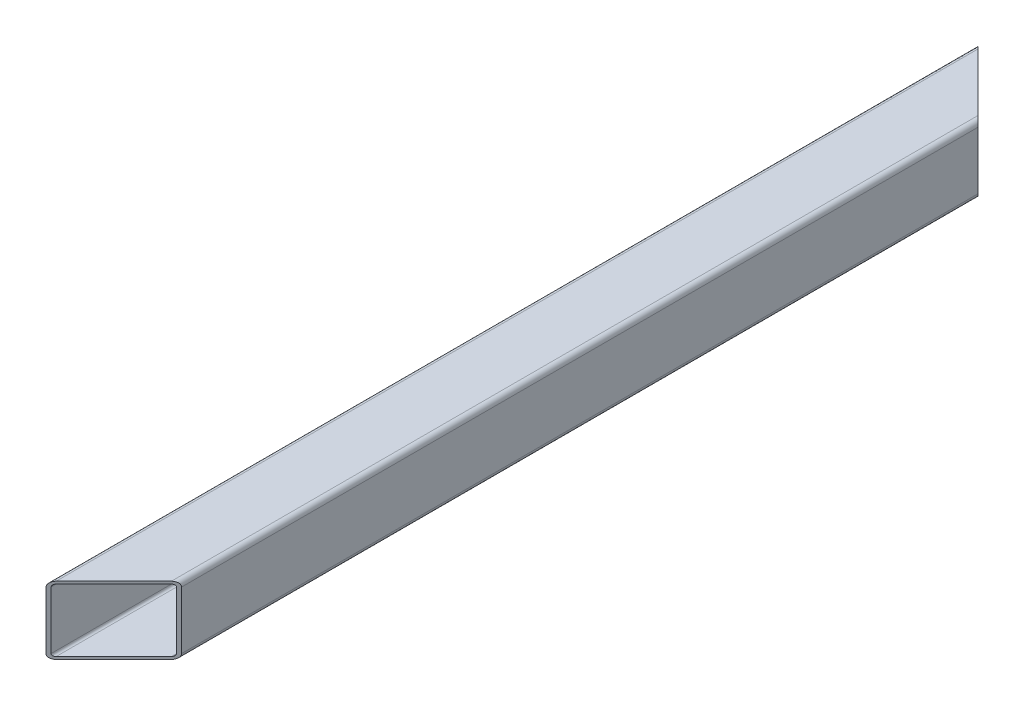
from build123d import *

# Parameters (mm, degrees)
AUFSATZ_LINEAR_AUSTRAGEN1_DEPTH = 550
SCHNITT_LINEAR_AUSTRAGEN1_DEPTH = 140


with BuildPart() as part:
    # Skizze1 → Aufsatz-Linear austragen1 (new, symmetric)
    with BuildSketch(Plane.XY):
        with BuildLine():
            Line((-34, 40), (34, 40))
            ThreePointArc((34, 40), (38.242640687, 38.242640687), (40, 34))
            Line((40, 34), (40, -34))
            ThreePointArc((40, -34), (38.242640687, -38.242640687), (34, -40))
            Line((34, -40), (-34, -40))
            ThreePointArc((-34, -40), (-38.242640687, -38.242640687), (-40, -34))
            Line((-40, -34), (-40, 34))
            ThreePointArc((-40, 34), (-38.242640687, 38.242640687), (-34, 40))
        make_face()
        with BuildLine():
            Line((-37, 34), (-37, -34))
            ThreePointArc((-37, -34), (-36.121320344, -36.121320344), (-34, -37))
            Line((-34, -37), (34, -37))
            ThreePointArc((34, -37), (36.121320344, -36.121320344), (37, -34))
            Line((37, -34), (37, 34))
            ThreePointArc((37, 34), (36.121320344, 36.121320344), (34, 37))
            Line((34, 37), (-34, 37))
            ThreePointArc((-34, 37), (-36.121320344, 36.121320344), (-37, 34))
        make_face(mode=Mode.SUBTRACT)
    extrude(amount=AUFSATZ_LINEAR_AUSTRAGEN1_DEPTH, both=True)

    # Skizze2 → Schnitt-Linear austragen1 (cut)
    with BuildSketch(Plane(origin=(0, 40, 0), x_dir=(1, 0, 0), z_dir=(0, 1, 0))):
        Polygon((-40, 550), (40, 550), (40, 470), align=None)
        Polygon((40, -470), (-40, -550), (40, -550), align=None)
    extrude(amount=-SCHNITT_LINEAR_AUSTRAGEN1_DEPTH, mode=Mode.SUBTRACT)


solid = part.part
